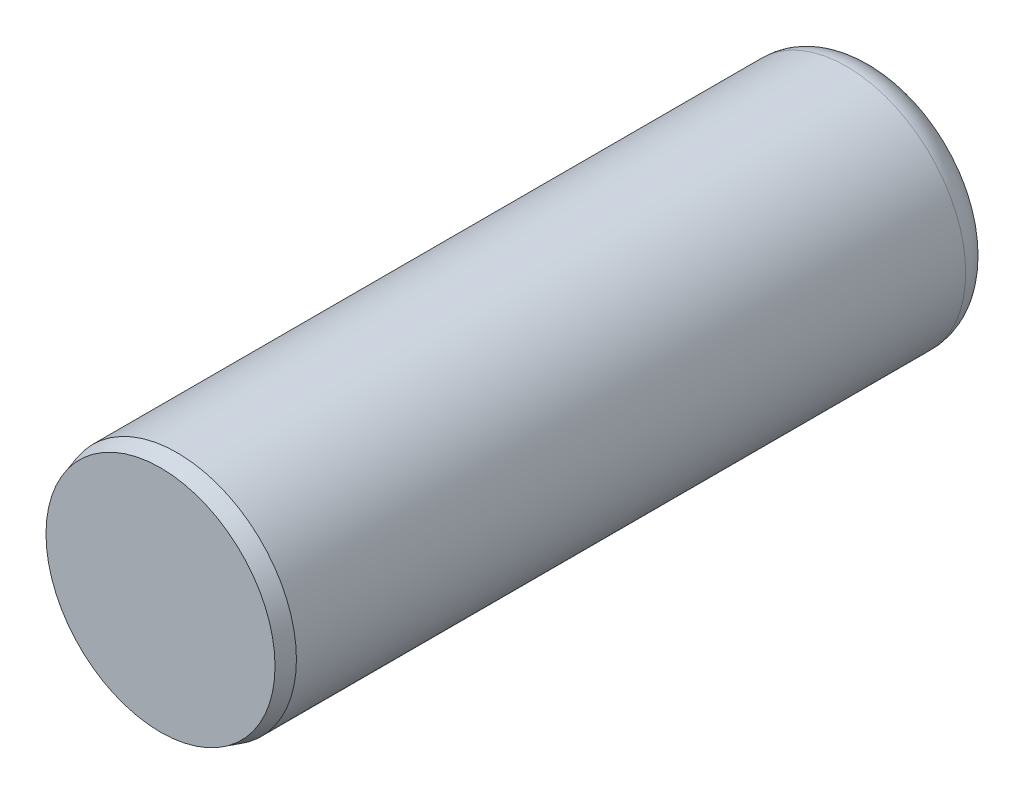
from build123d import *


with BuildPart() as part:
    # Sketch3 → Revolve1 (revolve)
    with BuildSketch(Plane(origin=(0, 0, 0), x_dir=(0, 0, -1), z_dir=(1, 0, 0)), mode=Mode.PRIVATE) as revolve1_sk:
        with BuildLine():
            Line((38.1, 9.525), (38.1, 0))
            Line((38.1, 0), (-38.1, 0))
            Line((-38.1, 0), (-38.1, 12.192))
            Line((-38.1, 12.192), (-36.328393463, 12.7))
            Line((-36.328393463, 12.7), (34.925, 12.7))
            ThreePointArc((34.925, 12.7), (37.17006403, 11.77006403), (38.1, 9.525))
        make_face()
    revolve(revolve1_sk.sketch.rotate(Axis((0, 0, 38.1), (0, 0, -1)), 90), axis=Axis((0, 0, 38.1), (0, 0, -1)))


solid = part.part
